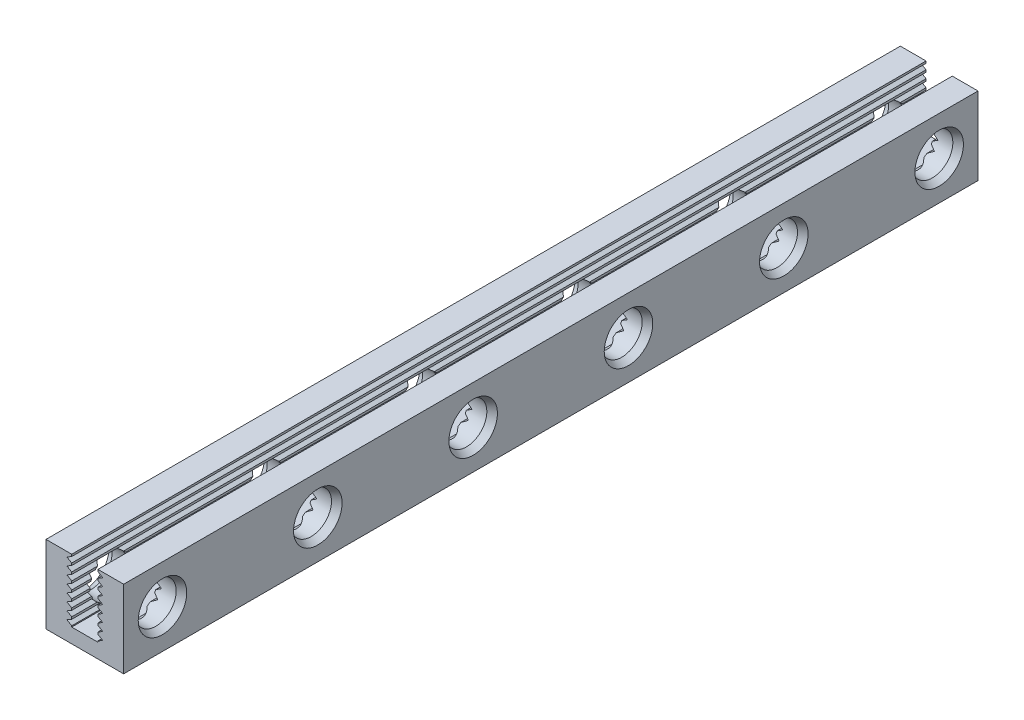
from build123d import *

# Parameters (mm, degrees)
BOSS_EXTRU_1_DEPTH         = 88
ENL_V_MAT_EXTRU_1_DEPTH    = 89.18163074
R_P_TITION_LIN_AIRE1_COUNT = 8
R_P_TITION_LIN_AIRE1_PITCH = 0.8
SYM_TRIE1_COPY_1_DEPTH     = 89.18163074
SYM_TRIE1_COPY_2_DEPTH     = 89.18163074
SYM_TRIE1_COPY_3_DEPTH     = 89.18163074
SYM_TRIE1_COPY_4_DEPTH     = 89.18163074
SYM_TRIE1_COPY_5_DEPTH     = 89.18163074
SYM_TRIE1_COPY_6_DEPTH     = 89.18163074
SYM_TRIE1_COPY_7_DEPTH     = 89.18163074
D_GAGEMENT_M41_AT_2_COUNT  = 2
D_GAGEMENT_M41_AT_2_PITCH  = 16
D_GAGEMENT_M41_AT_3_COUNT  = 2
D_GAGEMENT_M41_AT_3_PITCH  = 32
D_GAGEMENT_M41_AT_4_COUNT  = 2
D_GAGEMENT_M41_AT_4_PITCH  = 48
D_GAGEMENT_M41_AT_5_COUNT  = 2
D_GAGEMENT_M41_AT_5_PITCH  = 64
D_GAGEMENT_M41_AT_6_COUNT  = 2
D_GAGEMENT_M41_AT_6_PITCH  = 80


with BuildPart() as part:
    # Esquisse1 → Boss.-Extru.1 (new body)
    with BuildSketch(Plane.XY):
        Polygon((-4, 4), (-1.35, 4), (-1.35, -2.5), (1.35, -2.5), (1.35, 4), (4, 4), (4, -4), (-4, -4), align=None)
    extrude(amount=BOSS_EXTRU_1_DEPTH)

    # Esquisse2 → Enlèv. mat.-Extru.1 (cut, through all)
    with BuildSketch(Plane.XY.offset(88)):
        Polygon((-1.35, -1.807649731), (-1.85, -2.096324865), (-1.35, -2.385), align=None)
    enl_v_mat_extru_1 = extrude(amount=-ENL_V_MAT_EXTRU_1_DEPTH, mode=Mode.SUBTRACT)

    # Répétition linéaire1: Enlèv. mat.-Extru.1 ×8
    with Locations(*[(0, i * R_P_TITION_LIN_AIRE1_PITCH, 0) for i in range(1, R_P_TITION_LIN_AIRE1_COUNT)]):
        add(enl_v_mat_extru_1, mode=Mode.SUBTRACT)

    # Symétrie1: Enlèv. mat.-Extru.1 across plane
    add(enl_v_mat_extru_1.mirror(Plane(origin=(0, 0, 0), x_dir=(0, 0, 1), z_dir=(1, 0, 0))), mode=Mode.SUBTRACT)

    # Symétrie1 copy 1 sketch → Symétrie1 copy 1 (cut, through all)
    with BuildSketch(Plane(origin=(0, 0.8, 88), x_dir=(-1, 0, 0), z_dir=(0, 0, 1))):
        Polygon((-1.35, 1.807649731), (-1.85, 2.096324865), (-1.35, 2.385), align=None)
    extrude(amount=-SYM_TRIE1_COPY_1_DEPTH, mode=Mode.SUBTRACT)

    # Symétrie1 copy 2 sketch → Symétrie1 copy 2 (cut, through all)
    with BuildSketch(Plane(origin=(0, 1.6, 88), x_dir=(-1, 0, 0), z_dir=(0, 0, 1))):
        Polygon((-1.35, 1.807649731), (-1.85, 2.096324865), (-1.35, 2.385), align=None)
    extrude(amount=-SYM_TRIE1_COPY_2_DEPTH, mode=Mode.SUBTRACT)

    # Symétrie1 copy 3 sketch → Symétrie1 copy 3 (cut, through all)
    with BuildSketch(Plane(origin=(0, 2.4, 88), x_dir=(-1, 0, 0), z_dir=(0, 0, 1))):
        Polygon((-1.35, 1.807649731), (-1.85, 2.096324865), (-1.35, 2.385), align=None)
    extrude(amount=-SYM_TRIE1_COPY_3_DEPTH, mode=Mode.SUBTRACT)

    # Symétrie1 copy 4 sketch → Symétrie1 copy 4 (cut, through all)
    with BuildSketch(Plane(origin=(0, 3.2, 88), x_dir=(-1, 0, 0), z_dir=(0, 0, 1))):
        Polygon((-1.35, 1.807649731), (-1.85, 2.096324865), (-1.35, 2.385), align=None)
    extrude(amount=-SYM_TRIE1_COPY_4_DEPTH, mode=Mode.SUBTRACT)

    # Symétrie1 copy 5 sketch → Symétrie1 copy 5 (cut, through all)
    with BuildSketch(Plane(origin=(0, 4, 88), x_dir=(-1, 0, 0), z_dir=(0, 0, 1))):
        Polygon((-1.35, 1.807649731), (-1.85, 2.096324865), (-1.35, 2.385), align=None)
    extrude(amount=-SYM_TRIE1_COPY_5_DEPTH, mode=Mode.SUBTRACT)

    # Symétrie1 copy 6 sketch → Symétrie1 copy 6 (cut, through all)
    with BuildSketch(Plane(origin=(0, 4.8, 88), x_dir=(-1, 0, 0), z_dir=(0, 0, 1))):
        Polygon((-1.35, 1.807649731), (-1.85, 2.096324865), (-1.35, 2.385), align=None)
    extrude(amount=-SYM_TRIE1_COPY_6_DEPTH, mode=Mode.SUBTRACT)

    # Symétrie1 copy 7 sketch → Symétrie1 copy 7 (cut, through all)
    with BuildSketch(Plane(origin=(0, 5.6, 88), x_dir=(-1, 0, 0), z_dir=(0, 0, 1))):
        Polygon((-1.35, 1.807649731), (-1.85, 2.096324865), (-1.35, 2.385), align=None)
    extrude(amount=-SYM_TRIE1_COPY_7_DEPTH, mode=Mode.SUBTRACT)

    # Esquisse3 → Dégagement M41 (revolve, cut)
    with BuildSketch(Plane(origin=(-4, 0, 4), x_dir=(0, 0, 1), z_dir=(0, 1, 0))):
        Polygon((0, 0), (0, 8), (2.5, 8), (2.1, 7.307179677), (2.1, 0.692820323), (2.5, 0), align=None)
    d_gagement_m41 = revolve(axis=Axis((-10.35, 0, 4), (1, 0, 0)), mode=Mode.SUBTRACT)

    # Dégagement M41 at 2: Dégagement M41 ×2
    with Locations(*[(0, 0, i * D_GAGEMENT_M41_AT_2_PITCH) for i in range(1, D_GAGEMENT_M41_AT_2_COUNT)]):
        add(d_gagement_m41, mode=Mode.SUBTRACT)

    # Dégagement M41 at 3: Dégagement M41 ×2
    with Locations(*[(0, 0, i * D_GAGEMENT_M41_AT_3_PITCH) for i in range(1, D_GAGEMENT_M41_AT_3_COUNT)]):
        add(d_gagement_m41, mode=Mode.SUBTRACT)

    # Dégagement M41 at 4: Dégagement M41 ×2
    with Locations(*[(0, 0, i * D_GAGEMENT_M41_AT_4_PITCH) for i in range(1, D_GAGEMENT_M41_AT_4_COUNT)]):
        add(d_gagement_m41, mode=Mode.SUBTRACT)

    # Dégagement M41 at 5: Dégagement M41 ×2
    with Locations(*[(0, 0, i * D_GAGEMENT_M41_AT_5_PITCH) for i in range(1, D_GAGEMENT_M41_AT_5_COUNT)]):
        add(d_gagement_m41, mode=Mode.SUBTRACT)

    # Dégagement M41 at 6: Dégagement M41 ×2
    with Locations(*[(0, 0, i * D_GAGEMENT_M41_AT_6_PITCH) for i in range(1, D_GAGEMENT_M41_AT_6_COUNT)]):
        add(d_gagement_m41, mode=Mode.SUBTRACT)


solid = part.part
